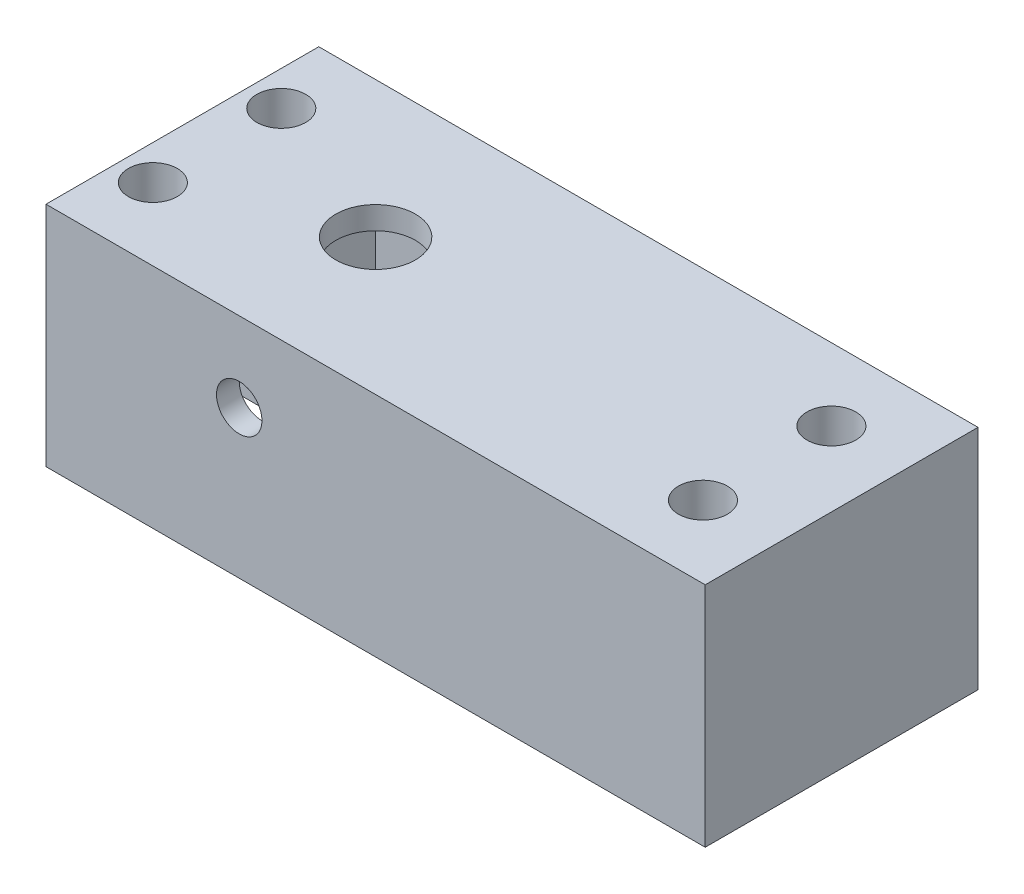
from build123d import *

# Parameters (mm, degrees)
SKETCH1_W                = 55
SKETCH1_H                = 20
BOSS_EXTRUDE1_DEPTH      = 7
SKETCH4_R                = 2.5
CUT_EXTRUDE3_DEPTH       = 1
SKETCH5_R                = 1.5
CUT_EXTRUDE4_DEPTH       = 41.197383539
SKETCH6_W                = 7
SKETCH6_H                = 20
BOSS_EXTRUDE2_DEPTH      = 18
SKETCH7_R                = 2.15
CUT_EXTRUDE5_DEPTH       = 7
SKETCH11_R               = 2.15
CUT_EXTRUDE6_DEPTH       = 7
SKETCH12_W               = 55
SKETCH12_H               = 25
BOSS_EXTRUDE3_DEPTH      = 2
SKETCH13_W               = 55
SKETCH13_H               = 25
BOSS_EXTRUDE4_DEPTH      = 2
SKETCH15_W               = 24
SKETCH15_H               = 25
BOSS_EXTRUDE5_DEPTH      = 10
SKETCH29_W               = 65
SKETCH29_H               = 24
CUT_EXTRUDE20_DEPTH      = 5
CUT_EXTRUDE21_DEPTH      = 45.585083194
CUT_EXTRUDE21_DEPTH_BACK = 45.585083194
SKETCH30_R               = 2
SKETCH31_R               = 3.5
CUT_EXTRUDE22_DEPTH      = 45.585083194
SKETCH32_W               = 24
SKETCH32_H               = 20
CUT_EXTRUDE23_DEPTH      = 7
SKETCH33_R               = 2.15
CUT_EXTRUDE24_DEPTH      = 43.811559694
SKETCH35_W               = 7
SKETCH35_H               = 2
CUT_EXTRUDE26_DEPTH      = 17


with BuildPart() as part:
    # Sketch1 → Boss-Extrude1 (new body)
    with BuildSketch(Plane(origin=(0, 0, 0), x_dir=(1, 0, 0), z_dir=(0, 1, 0))):
        with Locations((-6.848648349, 10)):
            Rectangle(SKETCH1_W, SKETCH1_H)
    extrude(amount=BOSS_EXTRUDE1_DEPTH)

    # Sketch4 → Cut-Extrude3 (cut)
    with BuildSketch(Plane(origin=(0, 7, 0), x_dir=(1, 0, 0), z_dir=(0, 1, 0))):
        with Locations(Location((-17.348648349, 10, 0), (0, 0, 270))):
            Circle(SKETCH4_R)
    extrude(amount=-CUT_EXTRUDE3_DEPTH, mode=Mode.SUBTRACT)

    # Sketch5 → Cut-Extrude4 (cut, through all)
    with BuildSketch(Plane(origin=(0, 6, 0), x_dir=(1, 0, 0), z_dir=(0, 1, 0))):
        with Locations(Location((-17.348648349, 10, 0), (0, 0, 270))):
            Circle(SKETCH5_R)
    extrude(amount=-CUT_EXTRUDE4_DEPTH, mode=Mode.SUBTRACT)

    # Sketch6 → Boss-Extrude2 (add)
    with BuildSketch(Plane(origin=(0, 0, 0), x_dir=(-1, 0, 0), z_dir=(0, -1, 0))):
        with Locations((30.848648349, 10)):
            Rectangle(SKETCH6_W, SKETCH6_H)
        with Locations((-17.151351651, 10)):
            Rectangle(SKETCH6_W, SKETCH6_H)
    extrude(amount=BOSS_EXTRUDE2_DEPTH)

    # Sketch7 → Cut-Extrude5 (cut)
    with BuildSketch(Plane(origin=(0, -18, 0), x_dir=(-1, 0, 0), z_dir=(0, -1, 0))):
        with Locations(Location((31.298648349, 15.65, 0), (0, 0, 90))):
            Circle(SKETCH7_R)
        with Locations(Location((31.298648349, 4.35, 0), (0, 0, 90))):
            Circle(SKETCH7_R)
    extrude(amount=-CUT_EXTRUDE5_DEPTH, mode=Mode.SUBTRACT)

    # Sketch11 → Cut-Extrude6 (cut)
    with BuildSketch(Plane(origin=(0, -18, 0), x_dir=(-1, 0, 0), z_dir=(0, -1, 0))):
        with Locations(Location((-17.101351651, 15.65, 0), (0, 0, 90))):
            Circle(SKETCH11_R)
        with Locations(Location((-17.101351651, 4.35, 0), (0, 0, 90))):
            Circle(SKETCH11_R)
    extrude(amount=-CUT_EXTRUDE6_DEPTH, mode=Mode.SUBTRACT)

    # Sketch12 → Boss-Extrude3 (add)
    with BuildSketch(Plane.XY):
        with Locations((-6.848648349, -5.5)):
            Rectangle(SKETCH12_W, SKETCH12_H)
    extrude(amount=BOSS_EXTRUDE3_DEPTH)

    # Sketch13 → Boss-Extrude4 (add)
    with BuildSketch(Plane(origin=(0, 0, -20), x_dir=(-1, 0, 0), z_dir=(0, 0, -1))):
        with Locations((6.848648349, -5.5)):
            Rectangle(SKETCH13_W, SKETCH13_H)
    extrude(amount=BOSS_EXTRUDE4_DEPTH)

    # Sketch15 → Boss-Extrude5 (add)
    with BuildSketch(Plane(origin=(20.651351651, 0, 0), x_dir=(0, 0, -1), z_dir=(1, 0, 0))):
        with Locations((10, -5.5)):
            Rectangle(SKETCH15_W, SKETCH15_H)
    extrude(amount=BOSS_EXTRUDE5_DEPTH)

    # Sketch29 → Cut-Extrude20 (cut)
    with BuildSketch(Plane(origin=(0, 7, 0), x_dir=(1, 0, 0), z_dir=(0, 1, 0))):
        with Locations((-1.848648349, 10)):
            Rectangle(SKETCH29_W, SKETCH29_H)
    extrude(amount=-CUT_EXTRUDE20_DEPTH, mode=Mode.SUBTRACT)

    # Sketch30 → Cut-Extrude21 (cut, two sides: drawn at the far end of the back side and taken through both)
    with BuildSketch(Plane(origin=(0, 0, 0), x_dir=(-1, 0, 0), z_dir=(0, 0, -1)).offset(-CUT_EXTRUDE21_DEPTH_BACK)):
        with Locations((17.348648349, -5)):
            Circle(SKETCH30_R)
    extrude(amount=CUT_EXTRUDE21_DEPTH + CUT_EXTRUDE21_DEPTH_BACK, mode=Mode.SUBTRACT)

    # Sketch31 → Cut-Extrude22 (cut, through all)
    with BuildSketch(Plane.XZ):
        with Locations(Location((-17.348648349, -10, 0), (0, 0, 270))):
            Circle(SKETCH31_R)
    extrude(amount=-CUT_EXTRUDE22_DEPTH, mode=Mode.SUBTRACT)

    # Sketch32 → Cut-Extrude23 (cut)
    with BuildSketch(Plane(origin=(30.651351651, 0, 0), x_dir=(0, 0, -1), z_dir=(1, 0, 0))):
        with Locations((10, -8)):
            Rectangle(SKETCH32_W, SKETCH32_H)
    extrude(amount=-CUT_EXTRUDE23_DEPTH, mode=Mode.SUBTRACT)

    # Sketch33 → Cut-Extrude24 (cut, through all)
    with BuildSketch(Plane.XZ.offset(11)):
        with Locations(Location((17.101351651, -15.65, 0), (0, 0, 270))):
            Circle(SKETCH33_R)
        with Locations(Location((17.101351651, -4.35, 0), (0, 0, 270))):
            Circle(SKETCH33_R)
        with Locations(Location((-31.298648349, -15.65, 0), (0, 0, 270))):
            Circle(SKETCH33_R)
        with Locations(Location((-31.298648349, -4.35, 0), (0, 0, 270))):
            Circle(SKETCH33_R)
    extrude(amount=-CUT_EXTRUDE24_DEPTH, mode=Mode.SUBTRACT)

    # Sketch35 → Cut-Extrude26 (cut)
    with BuildSketch(Plane.XZ.offset(18)):
        with Locations((-30.848648349, -9)):
            Rectangle(SKETCH35_W, SKETCH35_H)
        with Locations((-30.848648349, -11)):
            Rectangle(SKETCH35_W, SKETCH35_H)
    extrude(amount=-CUT_EXTRUDE26_DEPTH, mode=Mode.SUBTRACT)


solid = part.part
